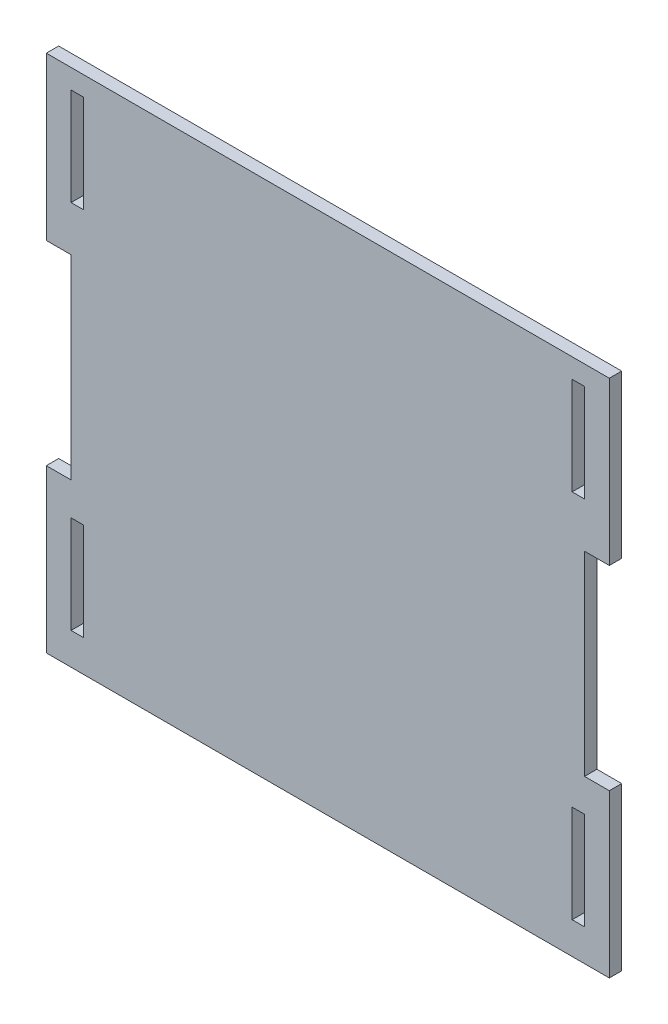
from build123d import *

# Parameters (mm, degrees)
SKETCH1_W           = 3.175
SKETCH1_H           = 25
BOSS_EXTRUDE1_DEPTH = 3.175


with BuildPart() as part:
    # Sketch1 → Boss-Extrude1 (new body)
    with BuildSketch(Plane.XY):
        Polygon((0, 91.5875), (6.35, 91.5875), (6.35, 41.5875), (0, 41.5875), (0, 0), (144.35, 0), (144.35, 41.5875), (138, 41.5875), (138, 91.5875), (144.35, 91.5875), (144.35, 133.175), (0, 133.175), align=None)
        with Locations((7.9375, 115.675)):
            Rectangle(SKETCH1_W, SKETCH1_H, mode=Mode.SUBTRACT)
        with Locations((136.4125, 115.675)):
            Rectangle(SKETCH1_W, SKETCH1_H, mode=Mode.SUBTRACT)
        with Locations((7.9375, 20.675)):
            Rectangle(SKETCH1_W, SKETCH1_H, mode=Mode.SUBTRACT)
        with Locations((136.4125, 20.675)):
            Rectangle(SKETCH1_W, SKETCH1_H, mode=Mode.SUBTRACT)
    extrude(amount=BOSS_EXTRUDE1_DEPTH)


solid = part.part
